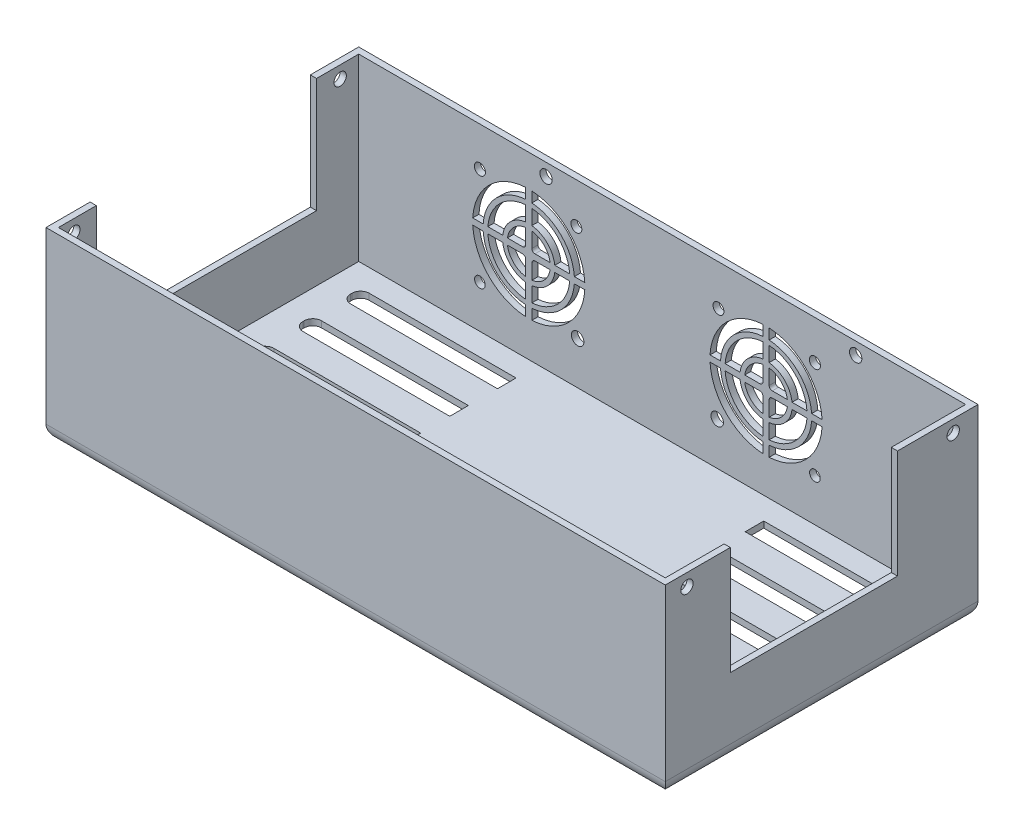
from build123d import *

# Parameters (mm, degrees)
CROQUIS1_W              = 200
CROQUIS1_H              = 101
SALIENTE_EXTRUIR1_DEPTH = 60
VACIADO1_T              = -2
REDONDEO3_R             = 5
CROQUIS3_R              = 2
CORTAR_EXTRUIR1_DEPTH   = 220
CROQUIS5_R              = 2
CORTAR_EXTRUIR3_DEPTH   = 10
CROQUIS8_R              = 1.76269117
CROQUIS8_R_2            = 1.719066469
CROQUIS8_R_3            = 1.79311053
CROQUIS8_R_4            = 2.024400235
CORTAR_EXTRUIR4_DEPTH   = 10
CROQUIS9_W              = 54
CROQUIS9_H              = 35
CORTAR_EXTRUIR5_DEPTH   = 10
CROQUIS10_W             = 71.123044139
CROQUIS10_H             = 36.985298978
CORTAR_EXTRUIR6_DEPTH   = 10
CORTAR_EXTRUIR7_DEPTH   = 10


with BuildPart() as part:
    # Croquis1 → Saliente-Extruir1 (new body)
    with BuildSketch(Plane(origin=(0, 0, 0), x_dir=(1, 0, 0), z_dir=(0, 1, 0))):
        Rectangle(CROQUIS1_W, CROQUIS1_H)
    extrude(amount=SALIENTE_EXTRUIR1_DEPTH)

    # Vaciado1
    vaciado1_openings = [part.faces().sort_by_distance(p)[0] for p in [
        (0, 60, 0),
    ]]
    offset(amount=VACIADO1_T, openings=vaciado1_openings, kind=Kind.INTERSECTION)

    # Redondeo3
    redondeo3_edges = [part.edges().sort_by_distance(p)[0] for p in [
        (0, 0, 50.5),
        (-100, 0, 0),
        (0, 0, -50.5),
        (100, 0, 0),
    ]]
    fillet(redondeo3_edges, radius=REDONDEO3_R)

    # Croquis3 → Cortar-Extruir1 (cut)
    with BuildSketch(Plane(origin=(100, 0, 0), x_dir=(0, 0, -1), z_dir=(1, 0, 0))):
        with Locations((-43.5, 56)):
            Circle(CROQUIS3_R)
        with Locations((42.5, 56)):
            Circle(CROQUIS3_R)
    extrude(amount=-CORTAR_EXTRUIR1_DEPTH, mode=Mode.SUBTRACT)

    # Croquis5 → Cortar-Extruir3 (cut)
    with BuildSketch(Plane(origin=(0, 0, -50.5), x_dir=(-1, 0, 0), z_dir=(0, 0, -1))):
        with Locations((-62.5, 56)):
            Circle(CROQUIS5_R)
        with Locations((37.5, 56)):
            Circle(CROQUIS5_R)
    extrude(amount=-CORTAR_EXTRUIR3_DEPTH, mode=Mode.SUBTRACT)

    # Croquis8 → Cortar-Extruir4 (cut)
    with BuildSketch(Plane(origin=(0, 0, -50.5), x_dir=(-1, 0, 0), z_dir=(0, 0, -1))):
        with Locations((-18.178781904, 46.955622044)):
            Circle(CROQUIS8_R)
        with Locations((-49.335190761, 15.799213188)):
            Circle(CROQUIS8_R_2)
        with Locations((-49.335190761, 47.374251843)):
            Circle(CROQUIS8_R_3)
        with Locations((-17.760152106, 15.799213188)):
            Circle(CROQUIS8_R_4)
        with Locations(Location((27.300556314, 15.799213188, 0), (0, 0, 180))):
            Circle(CROQUIS8_R_4)
        with Locations(Location((58.875594969, 47.374251843, 0), (0, 0, 180))):
            Circle(CROQUIS8_R_3)
        with Locations(Location((58.875594969, 15.799213188, 0), (0, 0, 180))):
            Circle(CROQUIS8_R_2)
        with Locations(Location((27.719186112, 46.955622044, 0), (0, 0, 180))):
            Circle(CROQUIS8_R)
        with BuildLine():
            Line((-46.765139764, 32.586732515), (-41.9459965, 32.586732515))
            ThreePointArc((-41.9459965, 32.586732515), (-39.528133954, 37.567195036), (-34.547671433, 39.985057582))
            Line((-34.547671433, 39.985057582), (-34.547671433, 44.804200846))
            ThreePointArc((-34.547671433, 44.804200846), (-42.9205437, 40.959604782), (-46.765139764, 32.586732515))
        make_face()
        with BuildLine():
            Line((56.305543972, 30.586732515), (51.486400708, 30.586732515))
            ThreePointArc((51.486400708, 30.586732515), (49.068538162, 25.606269994), (44.088075641, 23.188407448))
            Line((44.088075641, 23.188407448), (44.088075641, 18.369264185))
            ThreePointArc((44.088075641, 18.369264185), (52.460947908, 22.213860248), (56.305543972, 30.586732515))
        make_face()
        with BuildLine():
            Line((42.088075641, 16.865414697), (42.088075641, 13.491170274))
            ThreePointArc((42.088075641, 13.491170274), (30.273057639, 18.771714512), (24.9925134, 30.586732515))
            Line((24.9925134, 30.586732515), (28.366757823, 30.586732515))
            ThreePointArc((28.366757823, 30.586732515), (32.654543203, 21.153200076), (42.088075641, 16.865414697))
        make_face()
        with BuildLine():
            Line((-34.547671433, 49.682294756), (-34.547671433, 46.308050333))
            ThreePointArc((-34.547671433, 46.308050333), (-43.981203872, 42.020264954), (-48.268989251, 32.586732515))
            Line((-48.268989251, 32.586732515), (-51.643233674, 32.586732515))
            ThreePointArc((-51.643233674, 32.586732515), (-46.362689436, 44.401750518), (-34.547671433, 49.682294756))
        make_face()
        with BuildLine():
            Line((-32.547671433, 49.682294756), (-32.547671433, 46.308050333))
            ThreePointArc((-32.547671433, 46.308050333), (-23.114138995, 42.020264954), (-18.826353615, 32.586732515))
            Line((-18.826353615, 32.586732515), (-15.452109192, 32.586732515))
            ThreePointArc((-15.452109192, 32.586732515), (-20.732653431, 44.401750518), (-32.547671433, 49.682294756))
        make_face()
        with BuildLine():
            Line((-51.643233674, 30.586732515), (-48.268989251, 30.586732515))
            ThreePointArc((-48.268989251, 30.586732515), (-43.981203872, 21.153200076), (-34.547671433, 16.865414697))
            Line((-34.547671433, 16.865414697), (-34.547671433, 13.491170274))
            ThreePointArc((-34.547671433, 13.491170274), (-46.362689436, 18.771714512), (-51.643233674, 30.586732515))
        make_face()
        with BuildLine():
            Line((-34.547671433, 29.586732515), (-34.547671433, 24.701319651))
            ThreePointArc((-34.547671433, 24.701319651), (-38.467473782, 26.666930166), (-40.433084297, 30.586732515))
            Line((-40.433084297, 30.586732515), (-35.547671433, 30.586732515))
            ThreePointArc((-35.547671433, 30.586732515), (-34.840564652, 30.293839296), (-34.547671433, 29.586732515))
        make_face()
        with BuildLine():
            Line((-31.547671433, 32.586732515), (-26.662258569, 32.586732515))
            ThreePointArc((-26.662258569, 32.586732515), (-28.627869084, 36.506534864), (-32.547671433, 38.472145379))
            Line((-32.547671433, 38.472145379), (-32.547671433, 33.586732515))
            ThreePointArc((-32.547671433, 33.586732515), (-32.254778214, 32.879625734), (-31.547671433, 32.586732515))
        make_face()
        with BuildLine():
            Line((44.088075641, 16.865414697), (44.088075641, 13.491170274))
            ThreePointArc((44.088075641, 13.491170274), (55.903093644, 18.771714512), (61.183637882, 30.586732515))
            Line((61.183637882, 30.586732515), (57.809393459, 30.586732515))
            ThreePointArc((57.809393459, 30.586732515), (53.52160808, 21.153200076), (44.088075641, 16.865414697))
        make_face()
        with BuildLine():
            Line((-32.547671433, 29.586732515), (-32.547671433, 24.701319651))
            ThreePointArc((-32.547671433, 24.701319651), (-28.627869084, 26.666930166), (-26.662258569, 30.586732515))
            Line((-26.662258569, 30.586732515), (-31.547671433, 30.586732515))
            ThreePointArc((-31.547671433, 30.586732515), (-32.254778214, 30.293839296), (-32.547671433, 29.586732515))
        make_face()
        with BuildLine():
            Line((-32.547671433, 44.804200846), (-32.547671433, 39.985057582))
            ThreePointArc((-32.547671433, 39.985057582), (-27.567208912, 37.567195036), (-25.149346366, 32.586732515))
            Line((-25.149346366, 32.586732515), (-20.330203103, 32.586732515))
            ThreePointArc((-20.330203103, 32.586732515), (-24.174799166, 40.959604782), (-32.547671433, 44.804200846))
        make_face()
        with BuildLine():
            Line((-18.826353615, 30.586732515), (-15.452109192, 30.586732515))
            ThreePointArc((-15.452109192, 30.586732515), (-20.732653431, 18.771714512), (-32.547671433, 13.491170274))
            Line((-32.547671433, 13.491170274), (-32.547671433, 16.865414697))
            ThreePointArc((-32.547671433, 16.865414697), (-23.114138995, 21.153200076), (-18.826353615, 30.586732515))
        make_face()
        with BuildLine():
            Line((-25.149346366, 30.586732515), (-20.330203103, 30.586732515))
            ThreePointArc((-20.330203103, 30.586732515), (-24.174799166, 22.213860248), (-32.547671433, 18.369264185))
            Line((-32.547671433, 18.369264185), (-32.547671433, 23.188407448))
            ThreePointArc((-32.547671433, 23.188407448), (-27.567208912, 25.606269994), (-25.149346366, 30.586732515))
        make_face()
        with BuildLine():
            Line((-34.547671433, 23.188407448), (-34.547671433, 18.369264185))
            ThreePointArc((-34.547671433, 18.369264185), (-42.9205437, 22.213860248), (-46.765139764, 30.586732515))
            Line((-46.765139764, 30.586732515), (-41.9459965, 30.586732515))
            ThreePointArc((-41.9459965, 30.586732515), (-39.528133954, 25.606269994), (-34.547671433, 23.188407448))
        make_face()
        with BuildLine():
            Line((-40.433084297, 32.586732515), (-35.547671433, 32.586732515))
            ThreePointArc((-35.547671433, 32.586732515), (-34.840564652, 32.879625734), (-34.547671433, 33.586732515))
            Line((-34.547671433, 33.586732515), (-34.547671433, 38.472145379))
            ThreePointArc((-34.547671433, 38.472145379), (-38.467473782, 36.506534864), (-40.433084297, 32.586732515))
        make_face()
        with BuildLine():
            Line((42.088075641, 38.472145379), (42.088075641, 33.586732515))
            ThreePointArc((42.088075641, 33.586732515), (41.795182422, 32.879625734), (41.088075641, 32.586732515))
            Line((41.088075641, 32.586732515), (36.202662777, 32.586732515))
            ThreePointArc((36.202662777, 32.586732515), (38.168273292, 36.506534864), (42.088075641, 38.472145379))
        make_face()
        with BuildLine():
            Line((44.088075641, 38.472145379), (44.088075641, 33.586732515))
            ThreePointArc((44.088075641, 33.586732515), (44.38096886, 32.879625734), (45.088075641, 32.586732515))
            Line((45.088075641, 32.586732515), (49.973488505, 32.586732515))
            ThreePointArc((49.973488505, 32.586732515), (48.00787799, 36.506534864), (44.088075641, 38.472145379))
        make_face()
        with BuildLine():
            Line((49.973488505, 30.586732515), (45.088075641, 30.586732515))
            ThreePointArc((45.088075641, 30.586732515), (44.38096886, 30.293839296), (44.088075641, 29.586732515))
            Line((44.088075641, 29.586732515), (44.088075641, 24.701319651))
            ThreePointArc((44.088075641, 24.701319651), (48.00787799, 26.666930166), (49.973488505, 30.586732515))
        make_face()
        with BuildLine():
            Line((42.088075641, 23.188407448), (42.088075641, 18.369264185))
            ThreePointArc((42.088075641, 18.369264185), (33.715203374, 22.213860248), (29.870607311, 30.586732515))
            Line((29.870607311, 30.586732515), (34.689750574, 30.586732515))
            ThreePointArc((34.689750574, 30.586732515), (37.10761312, 25.606269994), (42.088075641, 23.188407448))
        make_face()
        with BuildLine():
            Line((34.689750574, 32.586732515), (29.870607311, 32.586732515))
            ThreePointArc((29.870607311, 32.586732515), (33.715203374, 40.959604782), (42.088075641, 44.804200846))
            Line((42.088075641, 44.804200846), (42.088075641, 39.985057582))
            ThreePointArc((42.088075641, 39.985057582), (37.10761312, 37.567195036), (34.689750574, 32.586732515))
        make_face()
        with BuildLine():
            Line((28.366757823, 32.586732515), (24.9925134, 32.586732515))
            ThreePointArc((24.9925134, 32.586732515), (30.273057639, 44.401750518), (42.088075641, 49.682294756))
            Line((42.088075641, 49.682294756), (42.088075641, 46.308050333))
            ThreePointArc((42.088075641, 46.308050333), (32.654543203, 42.020264954), (28.366757823, 32.586732515))
        make_face()
        with BuildLine():
            Line((44.088075641, 44.804200846), (44.088075641, 39.985057582))
            ThreePointArc((44.088075641, 39.985057582), (49.068538162, 37.567195036), (51.486400708, 32.586732515))
            Line((51.486400708, 32.586732515), (56.305543972, 32.586732515))
            ThreePointArc((56.305543972, 32.586732515), (52.460947908, 40.959604782), (44.088075641, 44.804200846))
        make_face()
        with BuildLine():
            Line((41.088075641, 30.586732515), (36.202662777, 30.586732515))
            ThreePointArc((36.202662777, 30.586732515), (38.168273292, 26.666930166), (42.088075641, 24.701319651))
            Line((42.088075641, 24.701319651), (42.088075641, 29.586732515))
            ThreePointArc((42.088075641, 29.586732515), (41.795182422, 30.293839296), (41.088075641, 30.586732515))
        make_face()
        with BuildLine():
            Line((61.183637882, 32.586732515), (57.809393459, 32.586732515))
            ThreePointArc((57.809393459, 32.586732515), (53.52160808, 42.020264954), (44.088075641, 46.308050333))
            Line((44.088075641, 46.308050333), (44.088075641, 49.682294756))
            ThreePointArc((44.088075641, 49.682294756), (55.903093644, 44.401750518), (61.183637882, 32.586732515))
        make_face()
    extrude(amount=-CORTAR_EXTRUIR4_DEPTH, mode=Mode.SUBTRACT)

    # Croquis9 → Cortar-Extruir5 (cut)
    with BuildSketch(Plane(origin=(100, 0, 0), x_dir=(0, 0, -1), z_dir=(1, 0, 0))):
        with Locations((-2.5, 42.5)):
            Rectangle(CROQUIS9_W, CROQUIS9_H)
    extrude(amount=-CORTAR_EXTRUIR5_DEPTH, mode=Mode.SUBTRACT)

    # Croquis10 → Cortar-Extruir6 (cut)
    with BuildSketch(Plane.ZY.offset(100)):
        with Locations((0.687946112, 41.507350511)):
            Rectangle(CROQUIS10_W, CROQUIS10_H)
    extrude(amount=-CORTAR_EXTRUIR6_DEPTH, mode=Mode.SUBTRACT)

    # Croquis11 → Cortar-Extruir7 (cut)
    with BuildSketch(Plane.XZ):
        with BuildLine():
            Line((-87.424158716, 26.303674941), (-40, 26.303674941))
            Line((-40, 26.303674941), (-40, 20.303674941))
            Line((-40, 20.303674941), (-87.424158716, 20.303674941))
            ThreePointArc((-87.424158716, 20.303674941), (-89.404057704, 21.123775953), (-90.224158716, 23.103674941))
            Line((-90.224158716, 23.103674941), (-90.224158716, 23.503674941))
            ThreePointArc((-90.224158716, 23.503674941), (-89.404057704, 25.483573928), (-87.424158716, 26.303674941))
        make_face()
        with BuildLine():
            Line((40, 10.900944343), (87.424158716, 10.900944343))
            ThreePointArc((87.424158716, 10.900944343), (89.404057704, 10.08084333), (90.224158716, 8.100944343))
            Line((90.224158716, 8.100944343), (90.224158716, 7.700944343))
            ThreePointArc((90.224158716, 7.700944343), (89.404057704, 5.721045355), (87.424158716, 4.900944343))
            Line((87.424158716, 4.900944343), (40, 4.900944343))
            Line((40, 4.900944343), (40, 10.900944343))
        make_face()
        with BuildLine():
            Line((-87.424158716, 41.706405539), (-40, 41.706405539))
            Line((-40, 41.706405539), (-40, 35.706405539))
            Line((-40, 35.706405539), (-87.424158716, 35.706405539))
            ThreePointArc((-87.424158716, 35.706405539), (-89.404057704, 36.526506552), (-90.224158716, 38.506405539))
            Line((-90.224158716, 38.506405539), (-90.224158716, 38.906405539))
            ThreePointArc((-90.224158716, 38.906405539), (-89.404057704, 40.886304526), (-87.424158716, 41.706405539))
        make_face()
        with BuildLine():
            Line((90.224158716, 38.906405539), (90.224158716, 38.506405539))
            ThreePointArc((90.224158716, 38.506405539), (89.404057704, 36.526506552), (87.424158716, 35.706405539))
            Line((87.424158716, 35.706405539), (40, 35.706405539))
            Line((40, 35.706405539), (40, 41.706405539))
            Line((40, 41.706405539), (87.424158716, 41.706405539))
            ThreePointArc((87.424158716, 41.706405539), (89.404057704, 40.886304526), (90.224158716, 38.906405539))
        make_face()
        with BuildLine():
            Line((90.224158716, 23.503674941), (90.224158716, 23.103674941))
            ThreePointArc((90.224158716, 23.103674941), (89.404057704, 21.123775953), (87.424158716, 20.303674941))
            Line((87.424158716, 20.303674941), (40, 20.303674941))
            Line((40, 20.303674941), (40, 26.303674941))
            Line((40, 26.303674941), (87.424158716, 26.303674941))
            ThreePointArc((87.424158716, 26.303674941), (89.404057704, 25.483573928), (90.224158716, 23.503674941))
        make_face()
        with BuildLine():
            Line((-87.424158716, 10.900944343), (-40, 10.900944343))
            Line((-40, 10.900944343), (-40, 4.900944343))
            Line((-40, 4.900944343), (-87.424158716, 4.900944343))
            ThreePointArc((-87.424158716, 4.900944343), (-89.404057704, 5.721045355), (-90.224158716, 7.700944343))
            Line((-90.224158716, 7.700944343), (-90.224158716, 8.100944343))
            ThreePointArc((-90.224158716, 8.100944343), (-89.404057704, 10.08084333), (-87.424158716, 10.900944343))
        make_face()
        with BuildLine():
            Line((-87.424158716, -4.501786256), (-40, -4.501786256))
            Line((-40, -4.501786256), (-40, -10.501786256))
            Line((-40, -10.501786256), (-87.424158716, -10.501786256))
            ThreePointArc((-87.424158716, -10.501786256), (-89.404057704, -9.681685243), (-90.224158716, -7.701786256))
            Line((-90.224158716, -7.701786256), (-90.224158716, -7.301786256))
            ThreePointArc((-90.224158716, -7.301786256), (-89.404057704, -5.321887268), (-87.424158716, -4.501786256))
        make_face()
        with BuildLine():
            Line((90.224158716, -7.301786256), (90.224158716, -7.701786256))
            ThreePointArc((90.224158716, -7.701786256), (89.404057704, -9.681685243), (87.424158716, -10.501786256))
            Line((87.424158716, -10.501786256), (40, -10.501786256))
            Line((40, -10.501786256), (40, -4.501786256))
            Line((40, -4.501786256), (87.424158716, -4.501786256))
            ThreePointArc((87.424158716, -4.501786256), (89.404057704, -5.321887268), (90.224158716, -7.301786256))
        make_face()
        with BuildLine():
            Line((-87.424158716, -19.904516854), (-40, -19.904516854))
            Line((-40, -19.904516854), (-40, -25.904516854))
            Line((-40, -25.904516854), (-87.424158716, -25.904516854))
            ThreePointArc((-87.424158716, -25.904516854), (-89.404057704, -25.084415841), (-90.224158716, -23.104516854))
            Line((-90.224158716, -23.104516854), (-90.224158716, -22.704516854))
            ThreePointArc((-90.224158716, -22.704516854), (-89.404057704, -20.724617866), (-87.424158716, -19.904516854))
        make_face()
        with BuildLine():
            Line((90.224158716, -22.704516854), (90.224158716, -23.104516854))
            ThreePointArc((90.224158716, -23.104516854), (89.404057704, -25.084415841), (87.424158716, -25.904516854))
            Line((87.424158716, -25.904516854), (40, -25.904516854))
            Line((40, -25.904516854), (40, -19.904516854))
            Line((40, -19.904516854), (87.424158716, -19.904516854))
            ThreePointArc((87.424158716, -19.904516854), (89.404057704, -20.724617866), (90.224158716, -22.704516854))
        make_face()
        with BuildLine():
            Line((-87.424158716, -35.307247452), (-40, -35.307247452))
            Line((-40, -35.307247452), (-40, -41.307247452))
            Line((-40, -41.307247452), (-87.424158716, -41.307247452))
            ThreePointArc((-87.424158716, -41.307247452), (-89.404057704, -40.487146439), (-90.224158716, -38.507247452))
            Line((-90.224158716, -38.507247452), (-90.224158716, -38.107247452))
            ThreePointArc((-90.224158716, -38.107247452), (-89.404057704, -36.127348465), (-87.424158716, -35.307247452))
        make_face()
        with BuildLine():
            Line((90.224158716, -38.107247452), (90.224158716, -38.507247452))
            ThreePointArc((90.224158716, -38.507247452), (89.404057704, -40.487146439), (87.424158716, -41.307247452))
            Line((87.424158716, -41.307247452), (40, -41.307247452))
            Line((40, -41.307247452), (40, -35.307247452))
            Line((40, -35.307247452), (87.424158716, -35.307247452))
            ThreePointArc((87.424158716, -35.307247452), (89.404057704, -36.127348465), (90.224158716, -38.107247452))
        make_face()
    extrude(amount=-CORTAR_EXTRUIR7_DEPTH, mode=Mode.SUBTRACT)


solid = part.part
